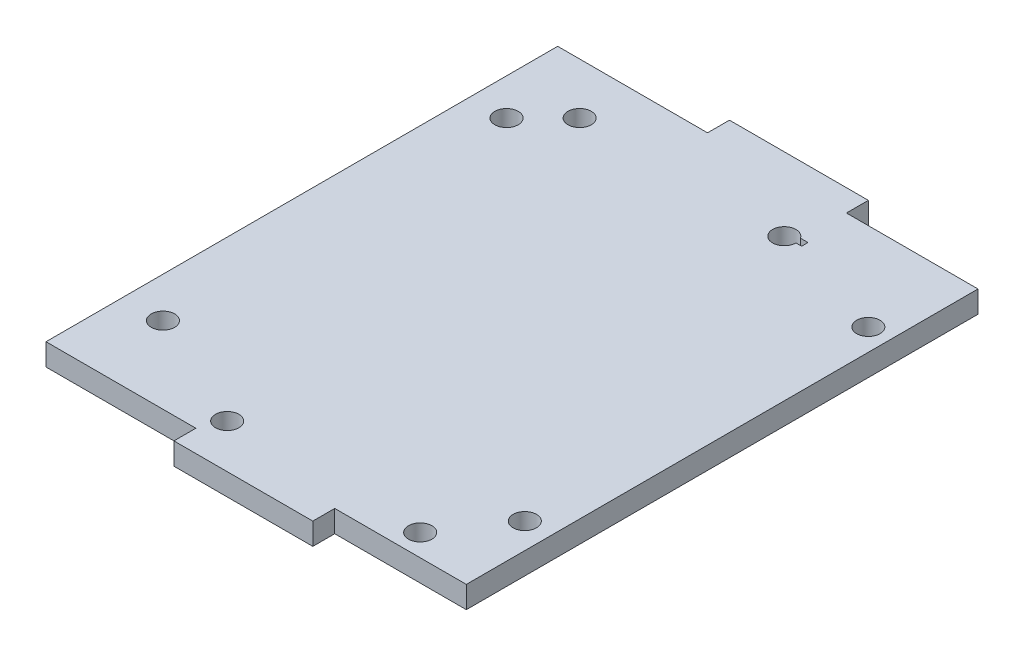
from build123d import *

# Parameters (mm, degrees)
SKETCH1_R           = 1.6
BOSS_EXTRUDE1_DEPTH = 3
SKETCH3_R           = 1.6
CUT_EXTRUDE1_DEPTH  = 10


with BuildPart() as part:
    # Sketch1 → Boss-Extrude1 (new body)
    with BuildSketch(Plane(origin=(0, 0, 0), x_dir=(1, 0, 0), z_dir=(0, 1, 0))):
        Polygon((63.79786164, -35), (63.79786164, 35), (45.79786164, 35), (45.79786164, 38), (26.79786164, 38), (26.79786164, 35), (8.79786164, 35), (6.29786164, 35), (6.29786164, -35), (8.79786164, -35), (26.79786164, -35), (26.79786164, -38), (45.79786164, -38), (45.79786164, -35), align=None)
        with Locations(Location((11.79786164, -24.5, 0), (0, 0, 270))):
            Circle(SKETCH1_R, mode=Mode.SUBTRACT)
        with Locations(Location((60.29786164, -23.5, 0), (0, 0, 270))):
            Circle(SKETCH1_R, mode=Mode.SUBTRACT)
        with Locations(Location((16.29786164, 28, 0), (0, 0, 270))):
            Circle(SKETCH1_R, mode=Mode.SUBTRACT)
        with BuildLine():
            Line((45.89786164, 28), (46.668055556, 28))
            Line((46.668055556, 28), (46.668055556, 28.874884233))
            Line((46.668055556, 28.874884233), (45.637480085, 28.874884233))
            ThreePointArc((45.637480085, 28.874884233), (42.764338, 27.543595307), (45.89786164, 28))
        make_face(mode=Mode.SUBTRACT)
    extrude(amount=BOSS_EXTRUDE1_DEPTH)

    # Sketch3 → Cut-Extrude1 (cut)
    with BuildSketch(Plane.XZ):
        with Locations(Location((11.29786164, -23, 0), (0, 0, 270))):
            Circle(SKETCH3_R)
        with Locations(Location((60.79786164, -23, 0), (0, 0, 270))):
            Circle(SKETCH3_R)
        with Locations(Location((54.48786164, 32, 0), (0, 0, 270))):
            Circle(SKETCH3_R)
        with Locations(Location((28.08786164, 32, 0), (0, 0, 270))):
            Circle(SKETCH3_R)
    extrude(amount=-CUT_EXTRUDE1_DEPTH, mode=Mode.SUBTRACT)


solid = part.part
